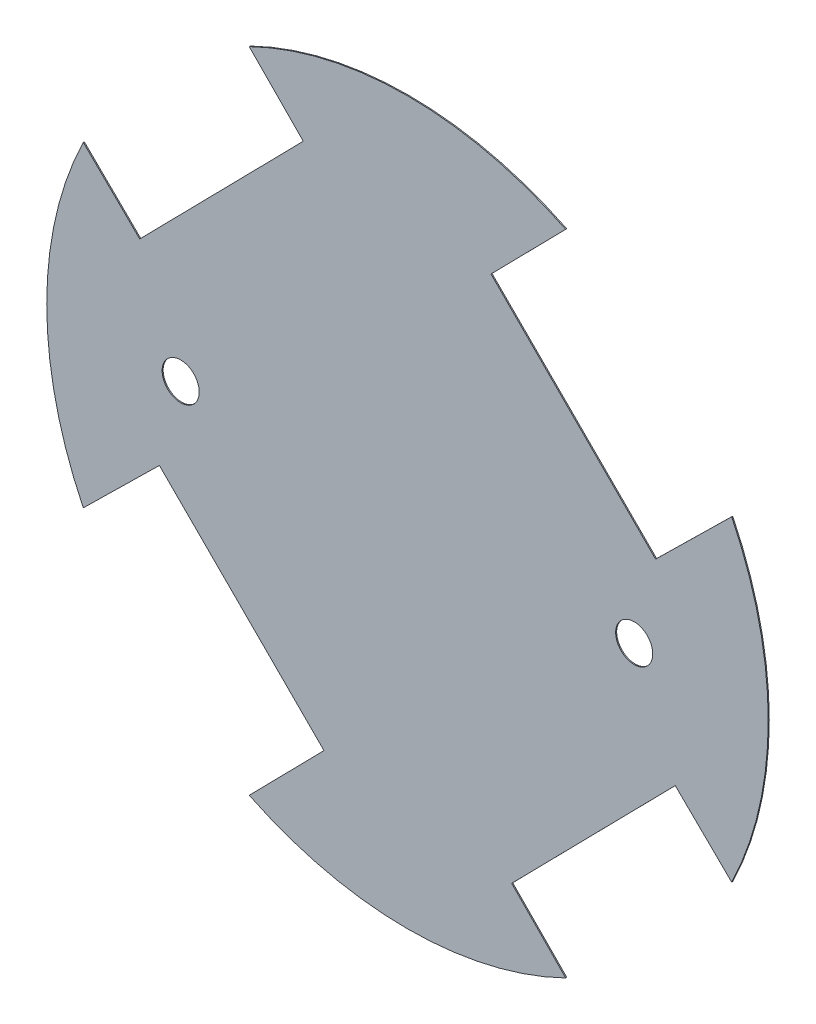
from build123d import *

# Parameters (mm, degrees)
BOSS_EXTRUDE1_DEPTH = 5
SKETCH3_R           = 90
CUT_EXTRUDE3_DEPTH  = 10


with BuildPart() as part:
    # Sketch2 → Boss-Extrude1 (new body)
    with BuildSketch(Plane.XY):
        with BuildLine():
            Line((767.947915583, -1572.625771149), (505.906479137, -1305.981517926))
            Line((505.906479137, -1305.981517926), (1299.211324809, -498.742094189))
            Line((1299.211324809, -498.742094189), (1572.883525326, -767.690161406))
            ThreePointArc((1572.883525326, -767.690161406), (1750.257754177, 0), (1572.883525326, 767.690161406))
            Line((1572.883525326, 767.690161406), (1203.829573729, 405.006824211))
            Line((1203.829573729, 405.006824211), (405.264578388, 1203.571819552))
            Line((405.264578388, 1203.571819552), (767.947915583, 1572.625771149))
            ThreePointArc((767.947915583, 1572.625771149), (0.257754177, 1750), (-767.432407229, 1572.625771149))
            Line((-767.432407229, 1572.625771149), (-505.390970783, 1305.981517926))
            Line((-505.390970783, 1305.981517926), (-1298.695816455, 498.742094189))
            Line((-1298.695816455, 498.742094189), (-1572.368016972, 767.690161406))
            ThreePointArc((-1572.368016972, 767.690161406), (-1749.742245823, 0), (-1572.368016972, -767.690161406))
            Line((-1572.368016972, -767.690161406), (-1203.314065375, -405.006824211))
            Line((-1203.314065375, -405.006824211), (-404.749070034, -1203.571819552))
            Line((-404.749070034, -1203.571819552), (-767.432407229, -1572.625771149))
            ThreePointArc((-767.432407229, -1572.625771149), (0.257754177, -1750), (767.947915583, -1572.625771149))
        make_face()
    extrude(amount=BOSS_EXTRUDE1_DEPTH)

    # Sketch3 → Cut-Extrude3 (cut)
    with BuildSketch(Plane.XY):
        with Locations((-1100, 0)):
            Circle(SKETCH3_R)
        with Locations((1100, 0)):
            Circle(SKETCH3_R)
    extrude(amount=CUT_EXTRUDE3_DEPTH, mode=Mode.SUBTRACT)


solid = part.part
